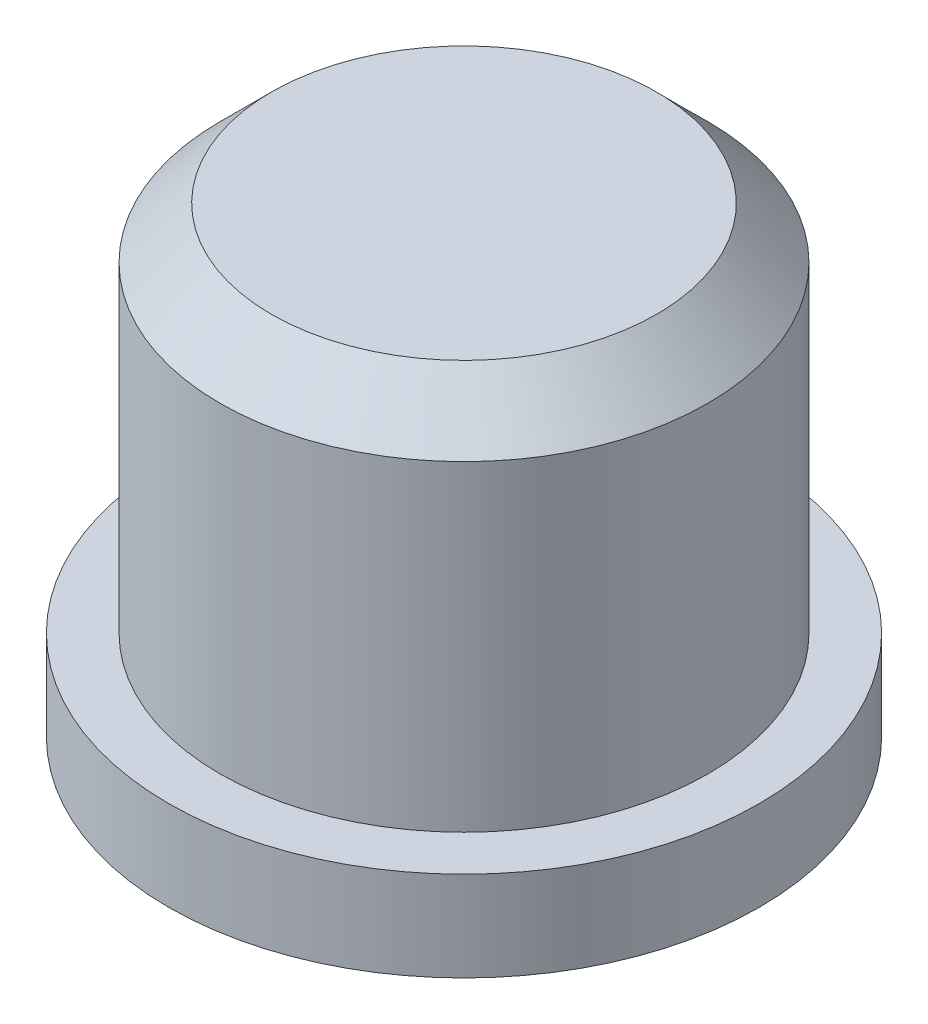
from build123d import *

# Parameters (mm, degrees)
SKETCH1_R           = 4.75
BOSS_EXTRUDE1_DEPTH = 9
SKETCH2_R           = 5.75
BOSS_EXTRUDE2_DEPTH = 1.75
CHAMFER1_SIZE       = 1


with BuildPart() as part:
    # Sketch1 → Boss-Extrude1 (new body)
    with BuildSketch(Plane(origin=(0, 0, 0), x_dir=(1, 0, 0), z_dir=(0, 1, 0))):
        with Locations(Location((0, 0, 0), (0, 0, 270))):
            Circle(SKETCH1_R)
    extrude(amount=BOSS_EXTRUDE1_DEPTH)

    # Sketch2 → Boss-Extrude2 (add)
    with BuildSketch(Plane.XZ):
        with Locations(Location((0, 0, 0), (0, 0, 270))):
            Circle(SKETCH2_R)
    extrude(amount=-BOSS_EXTRUDE2_DEPTH)

    # Chamfer1
    chamfer1_edges = [part.edges().sort_by_distance(p)[0] for p in [
        (0, 9, -4.75),
    ]]
    chamfer(chamfer1_edges, length=CHAMFER1_SIZE)


solid = part.part
